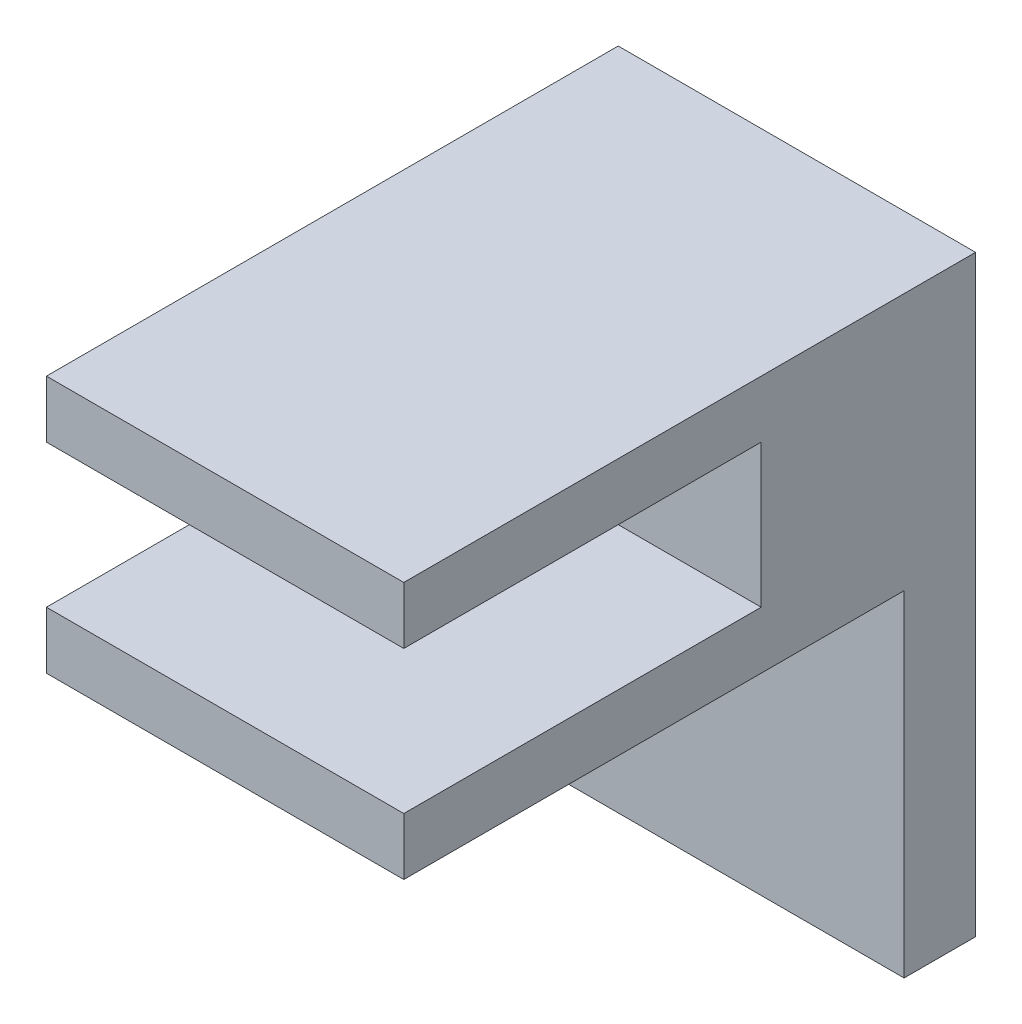
from build123d import *

# Parameters (mm, degrees)
EXTRUDE_1_DEPTH = 12.5


with BuildPart() as part:
    # 草图1 → 凸台-拉伸1 (new, symmetric)
    with BuildSketch(Plane(origin=(0, 0, 0), x_dir=(0, 0, -1), z_dir=(1, 0, 0))):
        Polygon((-40, 14.827740225), (-40, 18.827740225), (0, 18.827740225), (0, 0), (0, -22.636773072), (-5, -22.636773072), (-5, 0.827740225), (-40, 0.827740225), (-40, 4.827740225), (-15, 4.827740225), (-15, 14.827740225), align=None)
    extrude(amount=EXTRUDE_1_DEPTH, both=True)


solid = part.part
